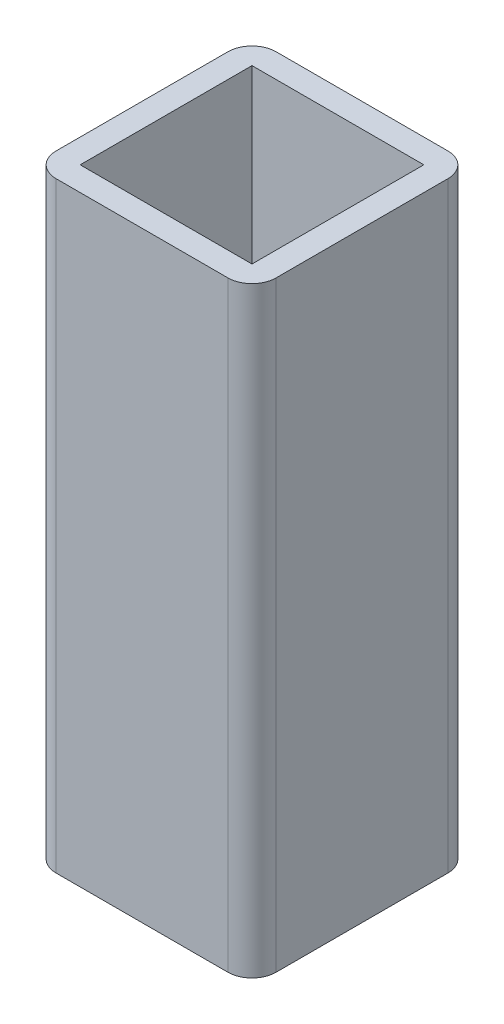
from build123d import *

# Parameters (mm, degrees)
BOSS_EXTRUDE1_DEPTH = 70
SKETCH3_W           = 20
SKETCH3_H           = 20
CUT_EXTRUDE1_DEPTH  = 1040.5


with BuildPart() as part:
    # Sketch1 → Boss-Extrude1 (new body)
    with BuildSketch(Plane(origin=(0, 0, 0), x_dir=(1, 0, 0), z_dir=(0, 1, 0))):
        with BuildLine():
            Line((2.8, 0), (22.8, 0))
            ThreePointArc((22.8, 0), (24.779898987, -0.820101013), (25.6, -2.8))
            Line((25.6, -2.8), (25.6, -22.8))
            ThreePointArc((25.6, -22.8), (24.779898987, -24.779898987), (22.8, -25.6))
            Line((22.8, -25.6), (2.8, -25.6))
            ThreePointArc((2.8, -25.6), (0.820101013, -24.779898987), (0, -22.8))
            Line((0, -22.8), (0, -2.8))
            ThreePointArc((0, -2.8), (0.820101013, -0.820101013), (2.8, 0))
        make_face()
    extrude(amount=BOSS_EXTRUDE1_DEPTH)

    # Sketch3 → Cut-Extrude1 (cut)
    with BuildSketch(Plane(origin=(0, 0, 0), x_dir=(-1, 0, 0), z_dir=(0, -1, 0))):
        with Locations((-12.8, -12.8)):
            Rectangle(SKETCH3_W, SKETCH3_H)
    extrude(amount=-CUT_EXTRUDE1_DEPTH, mode=Mode.SUBTRACT)


solid = part.part
